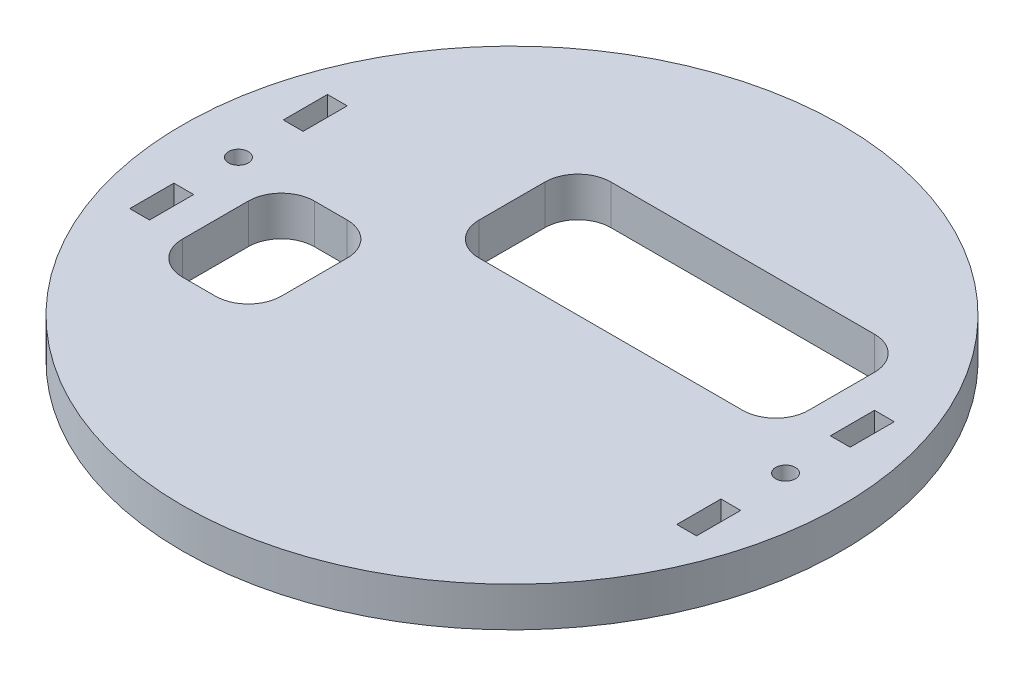
from build123d import *

# Parameters (mm, degrees)
SKETCH2_R           = 50
SKETCH2_R_2         = 1.5
SKETCH2_W           = 3
SKETCH2_H           = 6.7
BOSS_EXTRUDE2_DEPTH = 6


with BuildPart() as part:
    # Sketch2 → Boss-Extrude2 (new body)
    with BuildSketch(Plane(origin=(0, 0, 0), x_dir=(1, 0, 0), z_dir=(0, 1, 0))):
        with Locations(Location((-8.417247628, 8.35921329, 0), (0, 0, 270))):
            Circle(SKETCH2_R)
        with Locations(Location((33.082752372, 8.35921329, 0), (0, 0, 270))):
            Circle(SKETCH2_R_2, mode=Mode.SUBTRACT)
        with Locations(Location((-49.917247628, 8.35921329, 0), (0, 0, 270))):
            Circle(SKETCH2_R_2, mode=Mode.SUBTRACT)
        with Locations((-49.917247628, 20.00921329)):
            Rectangle(SKETCH2_W, SKETCH2_H, mode=Mode.SUBTRACT)
        with Locations((-49.917247628, -3.29078671)):
            Rectangle(SKETCH2_W, SKETCH2_H, mode=Mode.SUBTRACT)
        with Locations((33.082752372, 20.00921329)):
            Rectangle(SKETCH2_W, SKETCH2_H, mode=Mode.SUBTRACT)
        with Locations((33.082752372, -3.29078671)):
            Rectangle(SKETCH2_W, SKETCH2_H, mode=Mode.SUBTRACT)
        with BuildLine():
            Line((21.582752372, 33.35921329), (-18.417247628, 33.35921329))
            ThreePointArc((-18.417247628, 33.35921329), (-21.952781534, 31.894747196), (-23.417247628, 28.35921329))
            Line((-23.417247628, 28.35921329), (-23.417247628, 18.35921329))
            ThreePointArc((-23.417247628, 18.35921329), (-21.952781534, 14.823679384), (-18.417247628, 13.35921329))
            Line((-18.417247628, 13.35921329), (21.582752372, 13.35921329))
            ThreePointArc((21.582752372, 13.35921329), (25.118286278, 14.823679384), (26.582752372, 18.35921329))
            Line((26.582752372, 18.35921329), (26.582752372, 28.35921329))
            ThreePointArc((26.582752372, 28.35921329), (25.118286278, 31.894747196), (21.582752372, 33.35921329))
        make_face(mode=Mode.SUBTRACT)
        with BuildLine():
            Line((-33.417247628, 8.35921329), (-38.417247628, 8.35921329))
            ThreePointArc((-38.417247628, 8.35921329), (-41.952781534, 6.894747196), (-43.417247628, 3.35921329))
            Line((-43.417247628, 3.35921329), (-43.417247628, -6.64078671))
            ThreePointArc((-43.417247628, -6.64078671), (-41.952781534, -10.176320616), (-38.417247628, -11.64078671))
            Line((-38.417247628, -11.64078671), (-33.417247628, -11.64078671))
            ThreePointArc((-33.417247628, -11.64078671), (-29.881713722, -10.176320616), (-28.417247628, -6.64078671))
            Line((-28.417247628, -6.64078671), (-28.417247628, 3.35921329))
            ThreePointArc((-28.417247628, 3.35921329), (-29.881713722, 6.894747196), (-33.417247628, 8.35921329))
        make_face(mode=Mode.SUBTRACT)
    extrude(amount=BOSS_EXTRUDE2_DEPTH)


solid = part.part
